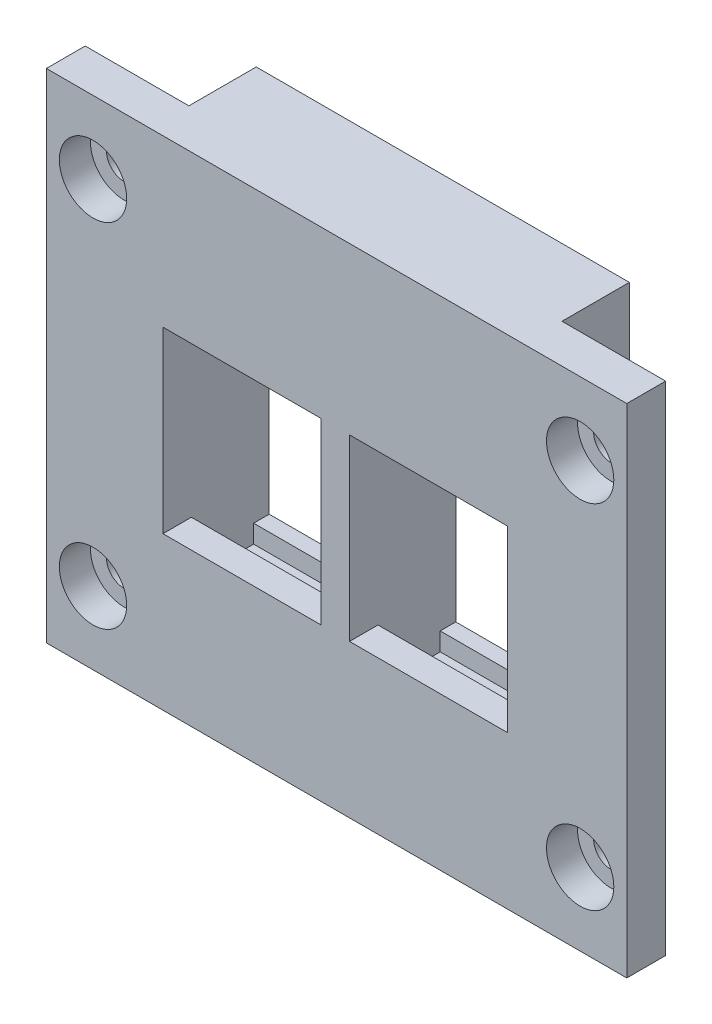
from build123d import *

# Parameters (mm, degrees)
BOSS_EXTRUDE1_DEPTH            = 6.5
BOSS_EXTRUDE1_DEPTH_BACK       = 3.75
SKETCH1_W                      = 36
SKETCH1_H                      = 48
SKETCH2_W                      = 56
SKETCH2_H                      = 48
BOSS_EXTRUDE2_DEPTH            = 3.75
CBORE_FOR_M3_SHCS1_D           = 3.4
CBORE_FOR_M3_SHCS1_DEPTH       = 10.1
CBORE_FOR_M3_SHCS1_CBORE_D     = 6.5
CBORE_FOR_M3_SHCS1_CBORE_DEPTH = 3
CBORE_FOR_M3_SHCS1_TIP         = 1.021463052
CUT_EXTRUDE1_DEPTH             = 15.25
LPATTERN1_COUNT                = 2
LPATTERN1_PITCH                = 18


with BuildPart() as part:
    # Sketch1 → Boss-Extrude1 (new, two sides: drawn at the far end of the back side and taken through both)
    with BuildSketch(Plane.XY.offset(-BOSS_EXTRUDE1_DEPTH_BACK)):
        Rectangle(SKETCH1_W, SKETCH1_H)
    extrude(amount=BOSS_EXTRUDE1_DEPTH + BOSS_EXTRUDE1_DEPTH_BACK)

    # Sketch2 → Boss-Extrude2 (add)
    with BuildSketch(Plane(origin=(0, 0, 6.5), x_dir=(-1, 0, 0), z_dir=(0, 0, -1))):
        Rectangle(SKETCH2_W, SKETCH2_H)
    extrude(amount=BOSS_EXTRUDE2_DEPTH)

    # CBORE for M3 SHCS1
    with Locations(Plane.XY.offset(6.5)):
        with Locations((-23.5, 17), (-23.5, -17), (23.5, 17), (23.5, -17)):
            CounterBoreHole(CBORE_FOR_M3_SHCS1_D / 2, CBORE_FOR_M3_SHCS1_CBORE_D / 2, CBORE_FOR_M3_SHCS1_CBORE_DEPTH, depth=CBORE_FOR_M3_SHCS1_DEPTH)
            with Locations((0, 0, -(CBORE_FOR_M3_SHCS1_DEPTH + CBORE_FOR_M3_SHCS1_TIP / 2))):  # 118° drill point
                Cone(0, CBORE_FOR_M3_SHCS1_D / 2, CBORE_FOR_M3_SHCS1_TIP, mode=Mode.SUBTRACT)

    # Sketch7 → Cut-Extrude1 (cut)
    with BuildSketch(Plane(origin=(16.5, 0, 0), x_dir=(0, 0, -1), z_dir=(1, 0, 0))):
        Polygon((-6.503383917, 8.006767833), (-3.756779362, 8.006767833), (-3.756779362, 9.003383917), (2.246616083, 9.003383917), (2.246616083, 7.503383917), (3.746616083, 7.503383917), (6.355468839, 7.503383917), (6.355468839, -12.746616083), (3.871124209, -12.746616083), (3.746616083, -12.746616083), (2.246616083, -12.746616083), (2.246616083, -14.496616083), (-3.756779362, -14.496616083), (-3.756779362, -9.25), (-6.503383917, -9.25), align=None)
    cut_extrude1 = extrude(amount=-CUT_EXTRUDE1_DEPTH, mode=Mode.SUBTRACT)

    # LPattern1: Cut-Extrude1 ×2
    with Locations(*[(-i * LPATTERN1_PITCH, 0, 0) for i in range(1, LPATTERN1_COUNT)]):
        add(cut_extrude1, mode=Mode.SUBTRACT)


solid = part.part
